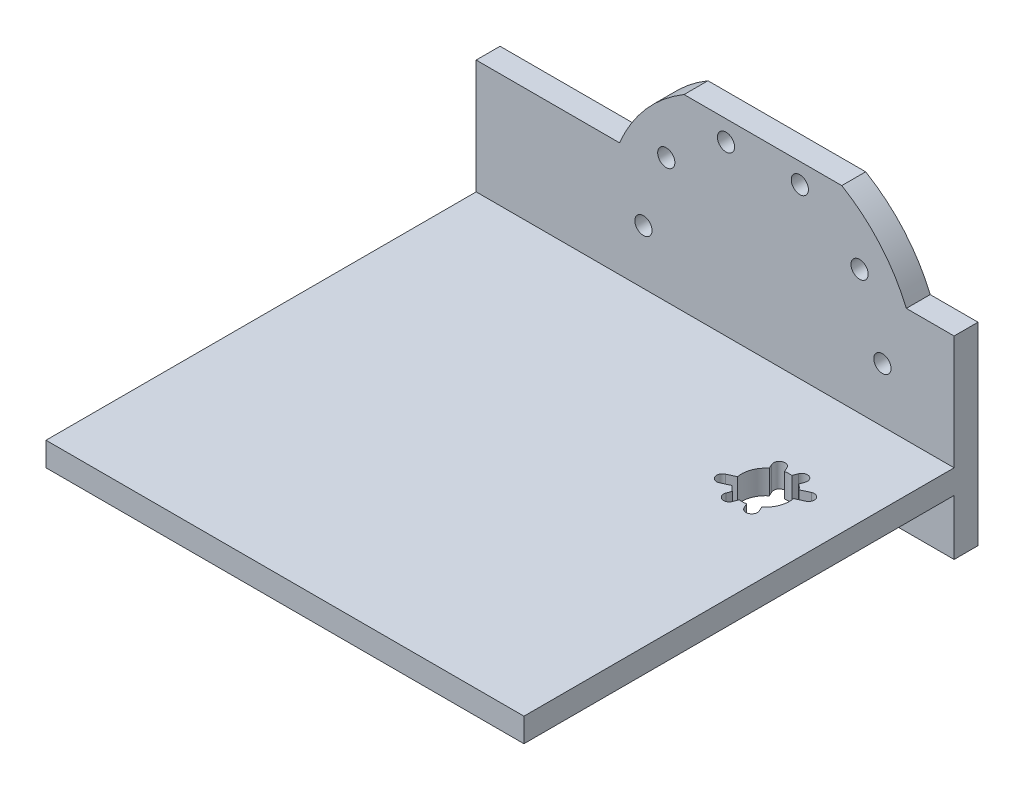
from build123d import *

# Parameters (mm, degrees)
SKETCH2_R           = 1.8
BOSS_EXTRUDE1_DEPTH = 5
SKETCH3_R           = 1.8
BOSS_EXTRUDE2_DEPTH = 5
BOSS_EXTRUDE3_DEPTH = 90
SKETCH5_R           = 1
CUT_EXTRUDE3_DEPTH  = 90
CUT_EXTRUDE4_DEPTH  = 90


with BuildPart() as part:
    # Sketch2 → Boss-Extrude1 (new body)
    with BuildSketch(Plane.XY):
        with BuildLine():
            ThreePointArc((30, 52.5), (24.507651866, 61.345374206), (16.5, 68))
            Line((16.5, 68), (-16.5, 68))
            ThreePointArc((-16.5, 68), (-24.507651866, 61.345374206), (-30, 52.5))
            Line((-30, 52.5), (-60, 52.5))
            Line((-60, 52.5), (-60, 12))
            Line((-60, 12), (40, 12))
            Line((40, 12), (40, 52.5))
            Line((40, 52.5), (30, 52.5))
        make_face()
        with Locations((-20.225424859, 25.305368693)):
            Circle(SKETCH2_R, mode=Mode.SUBTRACT)
        with Locations((-25, 40)):
            Circle(SKETCH2_R, mode=Mode.SUBTRACT)
        with Locations((-7.725424859, 16.223587093)):
            Circle(SKETCH2_R, mode=Mode.SUBTRACT)
        with Locations((7.725424859, 16.223587093)):
            Circle(SKETCH2_R, mode=Mode.SUBTRACT)
        with Locations((20.225424859, 25.305368693)):
            Circle(SKETCH2_R, mode=Mode.SUBTRACT)
        with Locations((25, 40)):
            Circle(SKETCH2_R, mode=Mode.SUBTRACT)
        with Locations((-20.225424859, 54.694631307)):
            Circle(SKETCH2_R, mode=Mode.SUBTRACT)
        with Locations((-7.725424859, 63.776412907)):
            Circle(SKETCH2_R, mode=Mode.SUBTRACT)
        with Locations((7.725424859, 63.776412907)):
            Circle(SKETCH2_R, mode=Mode.SUBTRACT)
        with Locations((20.225424859, 54.694631307)):
            Circle(SKETCH2_R, mode=Mode.SUBTRACT)
    extrude(amount=-BOSS_EXTRUDE1_DEPTH)

    # Sketch3 → Boss-Extrude2 (add)
    with BuildSketch(Plane.XY):
        with Locations((-20.225424859, 25.305368693)):
            Circle(SKETCH3_R)
        with Locations((20.225424859, 25.305368693)):
            Circle(SKETCH3_R)
    extrude(amount=-BOSS_EXTRUDE2_DEPTH)

    # Sketch4 → Boss-Extrude3 (add)
    with BuildSketch(Plane.XY):
        Polygon((15.062255845, 23.611), (32.664455845, 23.611), (40, 23.611), (40, 28.611), (-60, 28.611), (-60, 23.611), align=None)
    extrude(amount=BOSS_EXTRUDE3_DEPTH)

    # Sketch5 → Cut-Extrude3 (cut)
    with BuildSketch(Plane(origin=(0, 28.611, 0), x_dir=(1, 0, 0), z_dir=(0, 1, 0))):
        with BuildLine():
            ThreePointArc((20.99034902, -19.472254538), (21.854479486, -18.958084045), (22.806767952, -18.635222722))
            Line((22.806767952, -18.635222722), (22.305334768, -17.547076832))
            ThreePointArc((22.305334768, -17.547076832), (22.37390815, -17.751360934), (22.397125301, -17.96559274))
            ThreePointArc((22.397125301, -17.96559274), (21.611357108, -18.942375589), (20.488915835, -18.384108649))
            Line((20.488915835, -18.384108649), (20.99034902, -19.472254538))
        make_face()
        with BuildLine():
            ThreePointArc((24.550824941, -18.56697517), (25.525430896, -18.81443424), (26.42709796, -19.259506441))
            Line((26.42709796, -19.259506441), (26.841966492, -18.135504299))
            ThreePointArc((26.841966492, -18.135504299), (25.557564347, -18.727375172), (24.965693474, -17.442973027))
            Line((24.965693474, -17.442973027), (24.550824941, -18.56697517))
        make_face()
        with BuildLine():
            ThreePointArc((27.70859079, -20.444482658), (28.222761283, -21.308613124), (28.545622606, -22.260901591))
            Line((28.545622606, -22.260901591), (30.452700972, -21.382092612))
            ThreePointArc((30.452700972, -21.382092612), (29.125975597, -20.892399054), (29.615669155, -19.565673679))
            Line((29.615669155, -19.565673679), (27.70859079, -20.444482658))
        make_face()
        with BuildLine():
            ThreePointArc((25.421376922, -29.087902134), (25.91107048, -27.76117676), (27.237795855, -28.250870318))
            Line((27.237795855, -28.250870318), (26.73636267, -27.162724428))
            ThreePointArc((26.73636267, -27.162724428), (25.872232204, -27.676894921), (24.919943737, -27.999756245))
            Line((24.919943737, -27.999756245), (25.421376922, -29.087902134))
        make_face()
        with BuildLine():
            Line((22.761018216, -29.192005939), (23.175886748, -28.068003797))
            ThreePointArc((23.175886748, -28.068003797), (22.201280794, -27.820544727), (21.29961373, -27.375472525))
            Line((21.29961373, -27.375472525), (20.884745198, -28.499474668))
            ThreePointArc((20.884745198, -28.499474668), (21.998755939, -27.861327659), (22.822881707, -28.845740304))
            ThreePointArc((22.822881707, -28.845740304), (22.807294351, -29.021614536), (22.761018216, -29.192005939))
        make_face()
        with BuildLine():
            Line((18.111042534, -27.069305287), (20.0181209, -26.190496308))
            ThreePointArc((20.0181209, -26.190496308), (19.503950407, -25.326365842), (19.181089083, -24.374077376))
            Line((19.181089083, -24.374077376), (17.274010718, -25.252886355))
            ThreePointArc((17.274010718, -25.252886355), (18.231731639, -25.318921282), (18.692526626, -26.161095821))
            ThreePointArc((18.692526626, -26.161095821), (18.534701165, -26.700300834), (18.111042534, -27.069305287))
        make_face()
        with Locations((17.692526626, -26.161095821)):
            Circle(SKETCH5_R)
        with Locations((21.822881707, -28.845740304)):
            Circle(SKETCH5_R)
        with Locations((26.329586388, -28.669386226)):
            Circle(SKETCH5_R)
        with Locations((30.034185063, -20.473883145)):
            Circle(SKETCH5_R)
        with Locations((25.903829983, -17.789238663)):
            Circle(SKETCH5_R)
        with Locations((21.397125301, -17.96559274)):
            Circle(SKETCH5_R)
        with BuildLine():
            Line((22.806767952, -18.635222722), (23.76117853, -20.706361964))
            Line((23.76117853, -20.706361964), (24.550824941, -18.56697517))
            ThreePointArc((24.550824941, -18.56697517), (23.675668329, -18.521160325), (22.806767952, -18.635222722))
        make_face()
        with BuildLine():
            Line((23.068647258, -22.582634982), (23.76117853, -20.706361964))
            Line((23.76117853, -20.706361964), (22.806767952, -18.635222722))
            ThreePointArc((22.806767952, -18.635222722), (21.854479486, -18.958084045), (20.99034902, -19.472254538))
            Line((20.99034902, -19.472254538), (22.53663047, -22.827795925))
            Line((22.53663047, -22.827795925), (23.068647258, -22.582634982))
        make_face()
        with BuildLine():
            Line((19.181089083, -24.374077376), (22.53663047, -22.827795925))
            Line((22.53663047, -22.827795925), (20.99034902, -19.472254538))
            ThreePointArc((20.99034902, -19.472254538), (19.360300602, -21.655414432), (19.181089083, -24.374077376))
        make_face()
        with BuildLine():
            Line((22.089260142, -25.236085731), (22.781791413, -23.359812713))
            Line((22.781791413, -23.359812713), (22.53663047, -22.827795925))
            Line((22.53663047, -22.827795925), (19.181089083, -24.374077376))
            ThreePointArc((19.181089083, -24.374077376), (19.503950407, -25.326365842), (20.0181209, -26.190496308))
            Line((20.0181209, -26.190496308), (22.089260142, -25.236085731))
        make_face()
        with BuildLine():
            ThreePointArc((20.0181209, -26.190496308), (20.604554087, -26.841721471), (21.29961373, -27.375472525))
            Line((21.29961373, -27.375472525), (22.089260142, -25.236085731))
            Line((22.089260142, -25.236085731), (20.0181209, -26.190496308))
        make_face()
        with BuildLine():
            Line((23.175886748, -28.068003797), (23.96553316, -25.928617002))
            Line((23.96553316, -25.928617002), (23.373662287, -24.644214858))
            Line((23.373662287, -24.644214858), (22.089260142, -25.236085731))
            Line((22.089260142, -25.236085731), (21.29961373, -27.375472525))
            ThreePointArc((21.29961373, -27.375472525), (22.201280794, -27.820544727), (23.175886748, -28.068003797))
        make_face()
        with BuildLine():
            ThreePointArc((23.175886748, -28.068003797), (24.05104336, -28.113818642), (24.919943737, -27.999756245))
            Line((24.919943737, -27.999756245), (23.96553316, -25.928617002))
            Line((23.96553316, -25.928617002), (23.175886748, -28.068003797))
        make_face()
        with BuildLine():
            ThreePointArc((24.919943737, -27.999756245), (25.872232204, -27.676894921), (26.73636267, -27.162724428))
            Line((26.73636267, -27.162724428), (25.190081219, -23.807183041))
            Line((25.190081219, -23.807183041), (24.658064431, -24.052343984))
            Line((24.658064431, -24.052343984), (23.96553316, -25.928617002))
            Line((23.96553316, -25.928617002), (24.919943737, -27.999756245))
        make_face()
        with BuildLine():
            Line((25.190081219, -23.807183041), (26.73636267, -27.162724428))
            ThreePointArc((26.73636267, -27.162724428), (28.154651265, -25.468020492), (28.663355845, -23.317489483))
            ThreePointArc((28.663355845, -23.317489483), (28.633831736, -22.785925966), (28.545622606, -22.260901591))
            Line((28.545622606, -22.260901591), (25.190081219, -23.807183041))
        make_face()
        with BuildLine():
            Line((24.944920276, -23.275166254), (25.190081219, -23.807183041))
            Line((25.190081219, -23.807183041), (28.545622606, -22.260901591))
            ThreePointArc((28.545622606, -22.260901591), (28.222761283, -21.308613124), (27.70859079, -20.444482658))
            Line((27.70859079, -20.444482658), (25.637451548, -21.398893235))
            Line((25.637451548, -21.398893235), (24.944920276, -23.275166254))
        make_face()
        with BuildLine():
            Line((26.42709796, -19.259506441), (25.637451548, -21.398893235))
            Line((25.637451548, -21.398893235), (27.70859079, -20.444482658))
            ThreePointArc((27.70859079, -20.444482658), (27.122157603, -19.793257496), (26.42709796, -19.259506441))
        make_face()
        Polygon((24.353049403, -21.990764109), (24.944920276, -23.275166254), (25.637451548, -21.398893235), align=None)
        with BuildLine():
            Line((23.76117853, -20.706361964), (24.353049403, -21.990764109))
            Line((24.353049403, -21.990764109), (25.637451548, -21.398893235))
            Line((25.637451548, -21.398893235), (26.42709796, -19.259506441))
            ThreePointArc((26.42709796, -19.259506441), (25.525430896, -18.81443424), (24.550824941, -18.56697517))
            Line((24.550824941, -18.56697517), (23.76117853, -20.706361964))
        make_face()
        Polygon((23.068647258, -22.582634982), (24.353049403, -21.990764109), (23.76117853, -20.706361964), align=None)
        Polygon((22.781791413, -23.359812713), (23.068647258, -22.582634982), (22.53663047, -22.827795925), align=None)
        Polygon((22.089260142, -25.236085731), (23.373662287, -24.644214858), (22.781791413, -23.359812713), align=None)
        Polygon((23.96553316, -25.928617002), (24.658064431, -24.052343984), (23.373662287, -24.644214858), align=None)
        Polygon((24.658064431, -24.052343984), (25.190081219, -23.807183041), (24.944920276, -23.275166254), align=None)
        Polygon((24.658064431, -24.052343984), (24.944920276, -23.275166254), (24.353049403, -21.990764109), (23.068647258, -22.582634982), (22.781791413, -23.359812713), (23.373662287, -24.644214858), align=None)
    extrude(amount=-CUT_EXTRUDE3_DEPTH, mode=Mode.SUBTRACT)

    # Sketch6 → Cut-Extrude4 (cut)
    with BuildSketch(Plane(origin=(0, 28.611, 0), x_dir=(1, 0, 0), z_dir=(0, 1, 0))):
        with BuildLine():
            ThreePointArc((27.029593793, -18.204757426), (26.319348745, -16.663474852), (24.778066172, -17.3737199))
            Line((24.778066172, -17.3737199), (24.41831849, -18.34838328))
            ThreePointArc((24.41831849, -18.34838328), (23.667848016, -18.321313277), (22.92178772, -18.406944761))
            Line((22.92178772, -18.406944761), (22.486976661, -17.463373651))
            ThreePointArc((22.486976661, -17.463373651), (20.894906212, -16.875741381), (20.307273942, -18.46781183))
            Line((20.307273942, -18.46781183), (20.742085001, -19.411382941))
            ThreePointArc((20.742085001, -19.411382941), (19.1726733, -21.586161305), (18.952811123, -24.259057608))
            Line((18.952811123, -24.259057608), (17.190307536, -25.071244462))
            ThreePointArc((17.190307536, -25.071244462), (16.602675267, -26.663314911), (18.194745716, -27.250947181))
            Line((18.194745716, -27.250947181), (19.957249302, -26.438760327))
            ThreePointArc((19.957249302, -26.438760327), (20.46877068, -26.98856447), (21.056865578, -27.455558161))
            Line((21.056865578, -27.455558161), (20.697117896, -28.430221541))
            ThreePointArc((20.697117896, -28.430221541), (21.407362944, -29.971504114), (22.948645518, -29.261259066))
            Line((22.948645518, -29.261259066), (23.3083932, -28.286595687))
            ThreePointArc((23.3083932, -28.286595687), (24.058863673, -28.31366569), (24.804923969, -28.228034205))
            Line((24.804923969, -28.228034205), (25.239735029, -29.171605316))
            ThreePointArc((25.239735029, -29.171605316), (26.831805478, -29.759237586), (27.419437748, -28.167167136))
            Line((27.419437748, -28.167167136), (26.984626688, -27.223596026))
            ThreePointArc((26.984626688, -27.223596026), (28.55403839, -25.048817662), (28.773900567, -22.375921359))
            Line((28.773900567, -22.375921359), (30.536404153, -21.563734505))
            ThreePointArc((30.536404153, -21.563734505), (31.124036423, -19.971664056), (29.531965974, -19.384031786))
            Line((29.531965974, -19.384031786), (27.769462387, -20.19621864))
            ThreePointArc((27.769462387, -20.19621864), (27.257941009, -19.646414496), (26.669846111, -19.179420805))
            Line((26.669846111, -19.179420805), (27.029593793, -18.204757426))
        make_face()
        with BuildLine():
            ThreePointArc((19.181089083, -24.374077376), (19.360300602, -21.655414432), (20.99034902, -19.472254538))
            Line((20.99034902, -19.472254538), (20.488915835, -18.384108649))
            ThreePointArc((20.488915835, -18.384108649), (20.978609393, -17.057383274), (22.305334768, -17.547076832))
            Line((22.305334768, -17.547076832), (22.806767952, -18.635222722))
            ThreePointArc((22.806767952, -18.635222722), (23.675668329, -18.521160325), (24.550824941, -18.56697517))
            Line((24.550824941, -18.56697517), (24.965693474, -17.442973027))
            ThreePointArc((24.965693474, -17.442973027), (26.250095618, -16.851102154), (26.841966492, -18.135504299))
            Line((26.841966492, -18.135504299), (26.42709796, -19.259506441))
            ThreePointArc((26.42709796, -19.259506441), (27.122157603, -19.793257496), (27.70859079, -20.444482658))
            Line((27.70859079, -20.444482658), (29.615669155, -19.565673679))
            ThreePointArc((29.615669155, -19.565673679), (30.94239453, -20.055367237), (30.452700972, -21.382092612))
            Line((30.452700972, -21.382092612), (28.545622606, -22.260901591))
            ThreePointArc((28.545622606, -22.260901591), (28.366411088, -24.979564534), (26.73636267, -27.162724428))
            Line((26.73636267, -27.162724428), (27.237795855, -28.250870318))
            ThreePointArc((27.237795855, -28.250870318), (26.748102297, -29.577595692), (25.421376922, -29.087902134))
            Line((25.421376922, -29.087902134), (24.919943737, -27.999756245))
            ThreePointArc((24.919943737, -27.999756245), (24.05104336, -28.113818642), (23.175886748, -28.068003797))
            Line((23.175886748, -28.068003797), (22.761018216, -29.192005939))
            ThreePointArc((22.761018216, -29.192005939), (21.476616071, -29.783876813), (20.884745198, -28.499474668))
            Line((20.884745198, -28.499474668), (21.29961373, -27.375472525))
            ThreePointArc((21.29961373, -27.375472525), (20.604554087, -26.841721471), (20.0181209, -26.190496308))
            Line((20.0181209, -26.190496308), (18.111042534, -27.069305287))
            ThreePointArc((18.111042534, -27.069305287), (16.78431716, -26.579611729), (17.274010718, -25.252886355))
            Line((17.274010718, -25.252886355), (19.181089083, -24.374077376))
        make_face(mode=Mode.SUBTRACT)
    extrude(amount=-CUT_EXTRUDE4_DEPTH, mode=Mode.SUBTRACT)


solid = part.part
